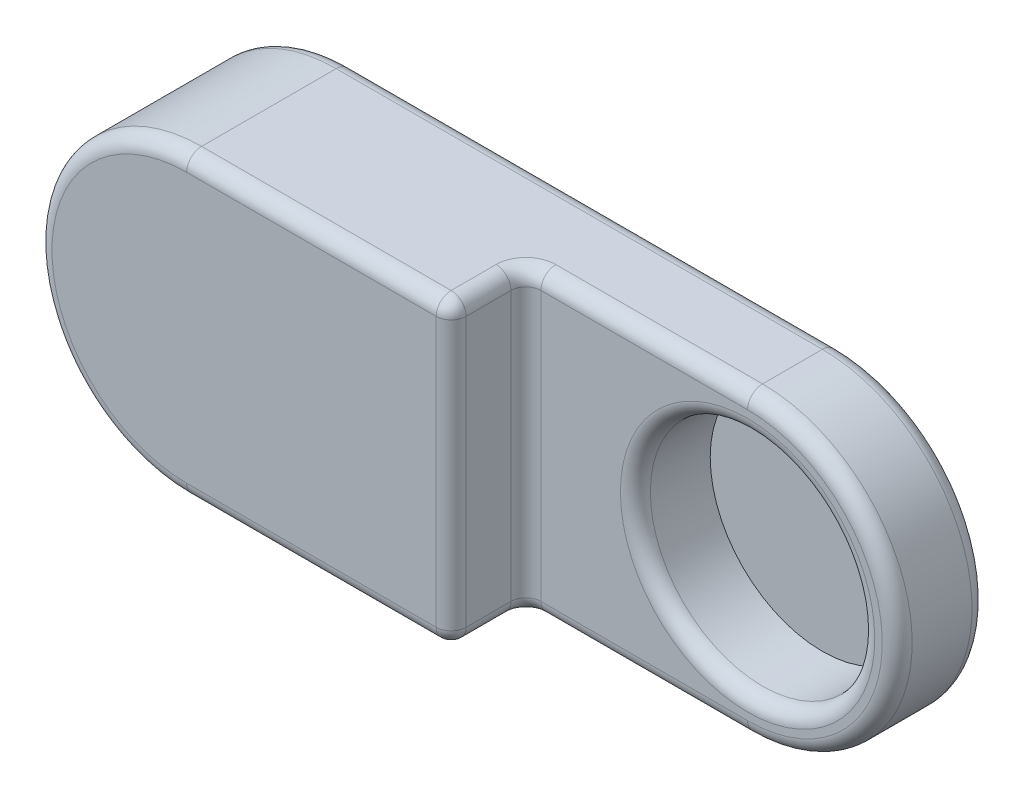
from build123d import *

# Parameters (mm, degrees)
SKIZZE1_R                       = 75
AUFSATZ_LINEAR_AUSTRAGEN1_DEPTH = 60
AUFSATZ_LINEAR_AUSTRAGEN2_DEPTH = 50
SKIZZE4_R                       = 74.91592882
AUFSATZ_LINEAR_AUSTRAGEN3_DEPTH = 10
VERRUNDUNG7_R                   = 10


with BuildPart() as part:
    # Skizze1 → Aufsatz-Linear austragen1 (new body)
    with BuildSketch(Plane.XY):
        with BuildLine():
            Line((0, 100), (325, 100))
            ThreePointArc((325, 100), (425, 0), (325, -100))
            Line((325, -100), (0, -100))
            ThreePointArc((0, -100), (-100, 0), (0, 100))
        make_face()
        Circle(SKIZZE1_R, mode=Mode.SUBTRACT)
        with Locations((325, 0)):
            Circle(SKIZZE1_R, mode=Mode.SUBTRACT)
    extrude(amount=AUFSATZ_LINEAR_AUSTRAGEN1_DEPTH)

    # Skizze2 → Aufsatz-Linear austragen2 (add)
    with BuildSketch(Plane.XY.offset(60)):
        with BuildLine():
            Line((0, 100), (176.830965538, 100))
            Line((176.830965538, 100), (176.830965538, -100))
            Line((176.830965538, -100), (0, -100))
            ThreePointArc((0, -100), (-100, 0), (0, 100))
        make_face()
    extrude(amount=AUFSATZ_LINEAR_AUSTRAGEN2_DEPTH)

    # Verrundung7
    verrundung7_edges = [part.edges().sort_by_distance(p)[0] for p in [
        (-75, 0, 0),
        (250, 0, 60),
        (250.915482769, -100, 60),
        (176.830965538, 0, 60),
        (176.830965538, -100, 85),
        (176.830965538, 100, 85),
        (-100, 0, 110),
        (88.415482769, -100, 110),
        (176.830965538, 0, 110),
        (88.415482769, 100, 110),
        (425, 0, 60),
        (162.5, -100, 0),
        (-100, 0, 0),
        (162.5, 100, 0),
        (425, 0, 0),
        (250.915482769, 100, 60),
    ]]
    fillet(verrundung7_edges, radius=VERRUNDUNG7_R)


with BuildPart() as body_2:
    # Skizze4 → Aufsatz-Linear austragen3 (new body)
    with BuildSketch(Plane(origin=(0, 0, 0), x_dir=(-1, 0, 0), z_dir=(0, 0, -1))):
        with Locations((-324.922829987, 0.033357945)):
            Circle(SKIZZE4_R)
    extrude(amount=-AUFSATZ_LINEAR_AUSTRAGEN3_DEPTH)


solid = Compound([part.part, body_2.part])
